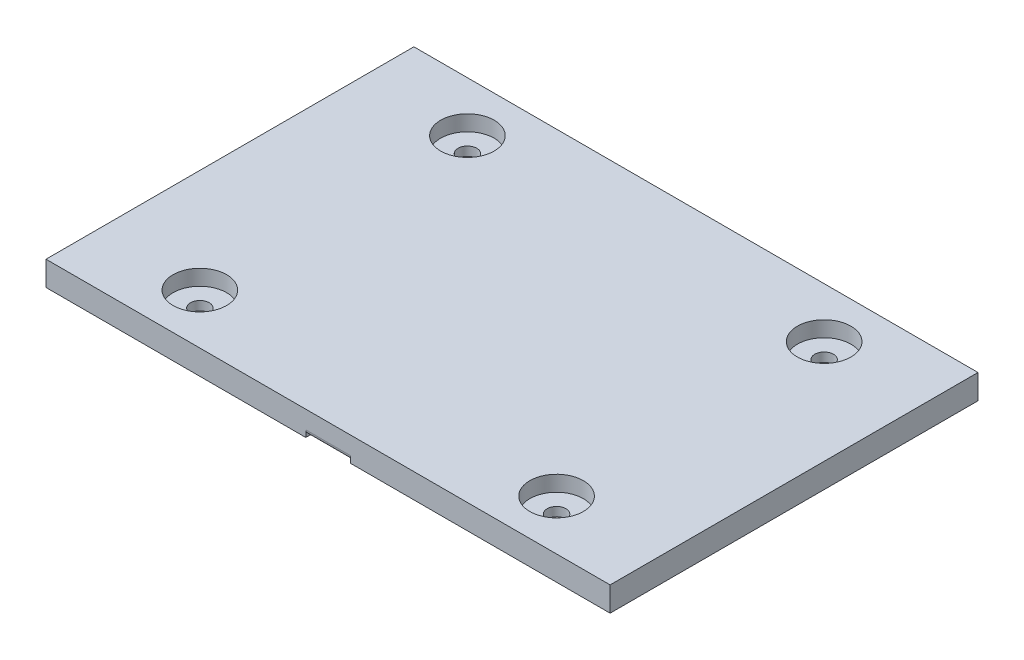
from build123d import *

# Parameters (mm, degrees)
SKETCH_1_W          = 126.5
SKETCH_1_H          = 82.5
SKETCH_1_R          = 2.1
EXTRUDE_1_DEPTH     = 2
CUT_EXTRUDE_1_DEPTH = 0.5
FILLET_1_R          = 1
SKETCH_4_W          = 126.5
SKETCH_4_H          = 82.5
SKETCH_4_R          = 6
EXTRUDE_3_DEPTH     = 3.5


with BuildPart() as part:
    # Эскиз1 → Бобышка-Вытянуть1 (new body)
    with BuildSketch(Plane(origin=(0, 60.645974268, 0), x_dir=(-1, 0, 0), z_dir=(0, -1, 0))):
        with Locations((-64.808980694, -89.523129836)):
            Rectangle(SKETCH_1_W, SKETCH_1_H)
        with Locations(Location((-24.808980694, -59.523129836, 0), (0, 0, 90))):
            Circle(SKETCH_1_R, mode=Mode.SUBTRACT)
        with Locations(Location((-104.808980694, -59.523129836, 0), (0, 0, 90))):
            Circle(SKETCH_1_R, mode=Mode.SUBTRACT)
        with Locations(Location((-24.808980694, -119.523129836, 0), (0, 0, 90))):
            Circle(SKETCH_1_R, mode=Mode.SUBTRACT)
        with Locations(Location((-104.808980694, -119.523129836, 0), (0, 0, 90))):
            Circle(SKETCH_1_R, mode=Mode.SUBTRACT)
    extrude(amount=EXTRUDE_1_DEPTH)

    # Эскиз3 → Вырез-Вытянуть1 (cut)
    with BuildSketch(Plane(origin=(0, 58.645974268, 0), x_dir=(-1, 0, 0), z_dir=(0, -1, 0))):
        Polygon((-59.808980694, -57.523129836), (-32.808980694, -57.523129836), (-32.808980694, -84.523129836), (-12.808980694, -84.523129836), (-12.808980694, -94.523129836), (-32.808980694, -94.523129836), (-32.808980694, -121.523129836), (-59.808980694, -121.523129836), (-59.808980694, -130.773129836), (-69.808980694, -130.773129836), (-69.808980694, -121.523129836), (-96.808980694, -121.523129836), (-96.808980694, -94.523129836), (-116.808980694, -94.523129836), (-116.808980694, -84.523129836), (-96.808980694, -84.523129836), (-96.808980694, -57.523129836), (-69.808980694, -57.523129836), (-69.808980694, -48.273129836), (-59.808980694, -48.273129836), align=None)
    extrude(amount=-CUT_EXTRUDE_1_DEPTH, mode=Mode.SUBTRACT)

    # Скругление1
    fillet_1_edges = [part.edges().sort_by_distance(p)[0] for p in [
        (64.808980694, 59.145974268, 130.773129836),
        (64.808980694, 59.145974268, 48.273129836),
    ]]
    fillet(fillet_1_edges, radius=FILLET_1_R)

    # Эскиз4 → Бобышка-Вытянуть3 (add)
    with BuildSketch(Plane(origin=(0, 60.645974268, 0), x_dir=(-1, 0, 0), z_dir=(0, -1, 0))):
        with Locations((-64.808980694, -89.523129836)):
            Rectangle(SKETCH_4_W, SKETCH_4_H)
        with Locations(Location((-24.808980694, -59.523129836, 0), (0, 0, 90))):
            Circle(SKETCH_4_R, mode=Mode.SUBTRACT)
        with Locations(Location((-104.808980694, -59.523129836, 0), (0, 0, 90))):
            Circle(SKETCH_4_R, mode=Mode.SUBTRACT)
        with Locations(Location((-104.808980694, -119.523129836, 0), (0, 0, 90))):
            Circle(SKETCH_4_R, mode=Mode.SUBTRACT)
        with Locations(Location((-24.808980694, -119.523129836, 0), (0, 0, 90))):
            Circle(SKETCH_4_R, mode=Mode.SUBTRACT)
    extrude(amount=-EXTRUDE_3_DEPTH)


solid = part.part
